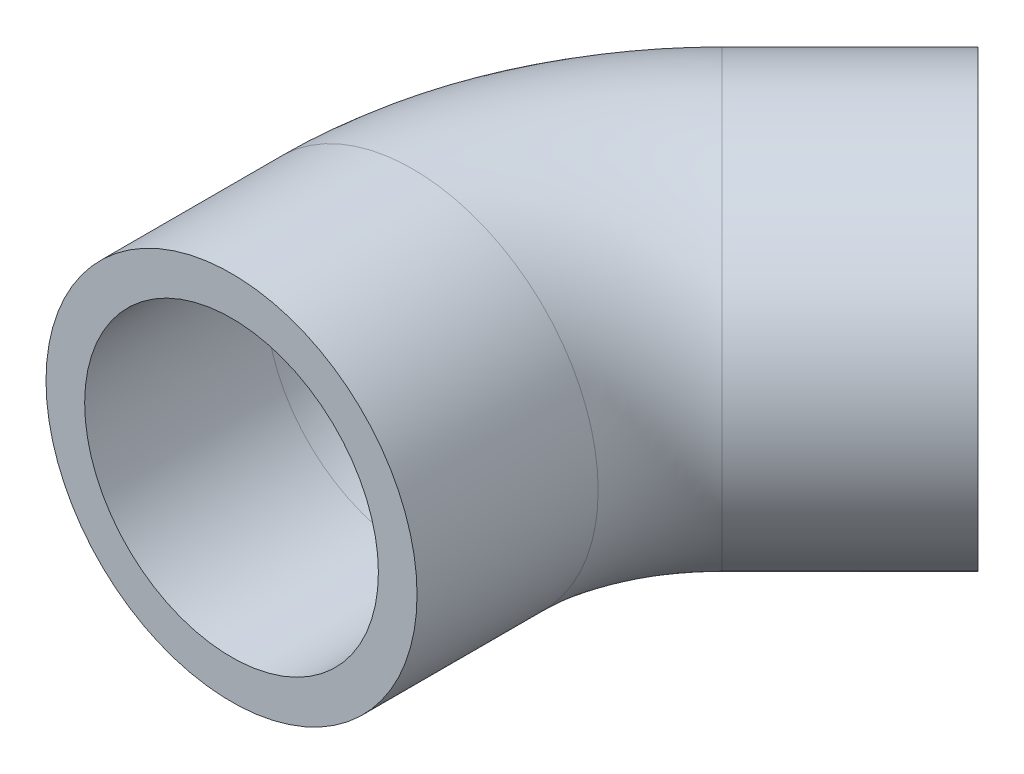
from build123d import *

# Parameters (mm, degrees)
SKETCH2_R   = 30.48
SKETCH2_R_2 = 24.13


with BuildPart() as part:
    # Sweep1: sweep along a path in Sketch1
    with BuildLine(Plane(origin=(0, 0, 0), x_dir=(1, 0, 0), z_dir=(0, 1, 0))) as sweep1_path:
        Line((0, 0), (0, 29.757951031))
        ThreePointArc((0, 29.757951031), (3.866919748, 49.198269396), (14.878975516, 65.678975516))
        Line((14.878975516, 65.678975516), (35.921024484, 86.721024484))
    # Sketch2 → Sweep1 (sweep)
    with BuildSketch(Plane.XY):
        Circle(SKETCH2_R)
        Circle(SKETCH2_R_2, mode=Mode.SUBTRACT)
    sweep(path=sweep1_path.line)


solid = part.part
